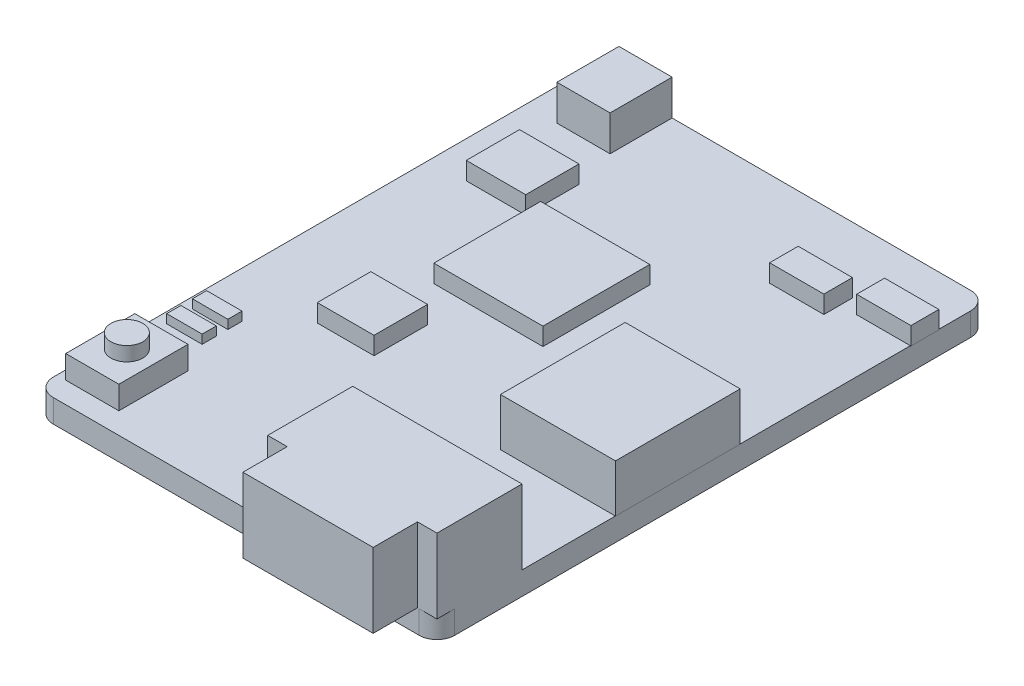
from build123d import *

# Parameters (mm, degrees)
SKETCH1_W               = 22.65
SKETCH1_H               = 31.12
PCB_DEPTH               = 1.3
SKETCH2_W               = 9.55
SKETCH2_H               = 7.3
IO_CONNECTOR_DEPTH      = 4.2
SKETCH3_W               = 3
SKETCH3_H               = 3.5
ANTENNA_CONNECTOR_DEPTH = 2
SKETCH15_W              = 3
SKETCH15_H              = 3.9
BUTTON_BASE_DEPTH       = 1.3
SKETCH16_R              = 0.9
BUTTON_TIP_DEPTH        = 0.8
SKETCH17_W              = 6.157933233
SKETCH17_H              = 6.029642957
SKETCH17_W_2            = 3.353874351
SKETCH17_H_2            = 3.005657888
SKETCH17_W_3            = 3.060639434
SKETCH17_H_3            = 1.576137673
SKETCH17_H_4            = 1.612792038
SKETCH17_W_4            = 3.201337113
SKETCH17_H_5            = 3.020980094
LOW_CHIPS_DEPTH         = 1
SKETCH18_W              = 6.492852738
SKETCH18_H              = 7.038252368
HIGH_CHIPS_DEPTH        = 2.7
SKETCH23_W              = 2
SKETCH23_H              = 0.8
LEDS_DEPTH              = 0.5
CORNERS_R               = 1
CUT_EXTRUDE1_REACH      = 24.031
SKETCH24_W              = 1.1
SKETCH24_H              = 2.5


with BuildPart() as part:
    # Sketch1 → PCB (new body)
    with BuildSketch(Plane(origin=(0, 0, 0), x_dir=(1, 0, 0), z_dir=(0, 1, 0))):
        Rectangle(SKETCH1_W, SKETCH1_H)
    extrude(amount=PCB_DEPTH)

    # Sketch2 → IO connector (add)
    with BuildSketch(Plane(origin=(0, 1.3, 0), x_dir=(1, 0, 0), z_dir=(0, 1, 0))):
        with Locations((6.55, -14.41)):
            Rectangle(SKETCH2_W, SKETCH2_H)
    extrude(amount=IO_CONNECTOR_DEPTH)

    # Sketch3 → Antenna connector (add)
    with BuildSketch(Plane(origin=(0, 1.3, 0), x_dir=(1, 0, 0), z_dir=(0, 1, 0))):
        with Locations((-8.025, 13.81)):
            Rectangle(SKETCH3_W, SKETCH3_H)
    extrude(amount=ANTENNA_CONNECTOR_DEPTH)

    # Sketch15 → Button base (add)
    with BuildSketch(Plane(origin=(0, 1.3, 0), x_dir=(1, 0, 0), z_dir=(0, 1, 0))):
        with Locations((-9.325, -12.41)):
            Rectangle(SKETCH15_W, SKETCH15_H)
    extrude(amount=BUTTON_BASE_DEPTH)

    # Sketch16 → Button tip (add)
    with BuildSketch(Plane(origin=(0, 2.6, 0), x_dir=(1, 0, 0), z_dir=(0, 1, 0))):
        with Locations(Location((-9.325, -12.41, 0), (0, 0, 90))):
            Circle(SKETCH16_R)
    extrude(amount=BUTTON_TIP_DEPTH)

    # Sketch17 → Low chips (add)
    with BuildSketch(Plane(origin=(0, 1.3, 0), x_dir=(1, 0, 0), z_dir=(0, 1, 0))):
        with Locations((-2.078363242, 3.759055692)):
            Rectangle(SKETCH17_W, SKETCH17_H)
        with Locations((-7.585681506, 8.185070203)):
            Rectangle(SKETCH17_W_2, SKETCH17_H_2)
        with Locations((9.825141625, 11.942142563)):
            Rectangle(SKETCH17_W_3, SKETCH17_H_3)
        with Locations((5.829815896, 11.044110633)):
            Rectangle(SKETCH17_W_3, SKETCH17_H_4)
        with Locations((-4.917111521, -2.959047528)):
            Rectangle(SKETCH17_W_4, SKETCH17_H_5)
    extrude(amount=LOW_CHIPS_DEPTH)

    # Sketch18 → High chips (add)
    with BuildSketch(Plane(origin=(0, 1.3, 0), x_dir=(1, 0, 0), z_dir=(0, 1, 0))):
        with Locations((8.086930252, -1.973636887)):
            Rectangle(SKETCH18_W, SKETCH18_H)
    extrude(amount=HIGH_CHIPS_DEPTH)

    # Sketch23 → LEDs (add)
    with BuildSketch(Plane(origin=(0, 1.3, 0), x_dir=(1, 0, 0), z_dir=(0, 1, 0))):
        with Locations((-9.725, -8.36)):
            Rectangle(SKETCH23_W, SKETCH23_H)
        with Locations((-9.725, -6.91)):
            Rectangle(SKETCH23_W, SKETCH23_H)
    extrude(amount=LEDS_DEPTH)

    # Corners
    corners_edges = [part.edges().sort_by_distance(p)[0] for p in [
        (11.325, 0.65, 15.56),
        (-11.325, 0.65, 15.56),
        (-11.325, 0.65, -15.56),
        (11.325, 0.65, -15.56),
    ]]
    fillet(corners_edges, radius=CORNERS_R)

    # Sketch24 → Cut-Extrude1 (cut, up to next)
    with BuildSketch(Plane(origin=(0, 5.5, 0), x_dir=(1, 0, 0), z_dir=(0, 1, 0)), mode=Mode.PRIVATE) as cut_extrude1_sk1:
        with Locations((10.775, -16.81)):
            Rectangle(SKETCH24_W, SKETCH24_H)
    cut_extrude1_tool1 = extrude(cut_extrude1_sk1.sketch, amount=-CUT_EXTRUDE1_REACH, mode=Mode.PRIVATE) & part.part
    # Sketch24 → Cut-Extrude1 (cut, up to next)
    with BuildSketch(Plane(origin=(0, 5.5, 0), x_dir=(1, 0, 0), z_dir=(0, 1, 0)), mode=Mode.PRIVATE) as cut_extrude1_sk2:
        with Locations((2.325, -16.81)):
            Rectangle(SKETCH24_W, SKETCH24_H)
    cut_extrude1_tool2 = extrude(cut_extrude1_sk2.sketch, amount=-CUT_EXTRUDE1_REACH, mode=Mode.PRIVATE) & part.part
    add(cut_extrude1_tool1.solids().sort_by_distance((10.775, 5.5, 16.81))[0], mode=Mode.SUBTRACT)
    add(cut_extrude1_tool2.solids().sort_by_distance((2.325, 5.5, 16.81))[0], mode=Mode.SUBTRACT)


solid = part.part
